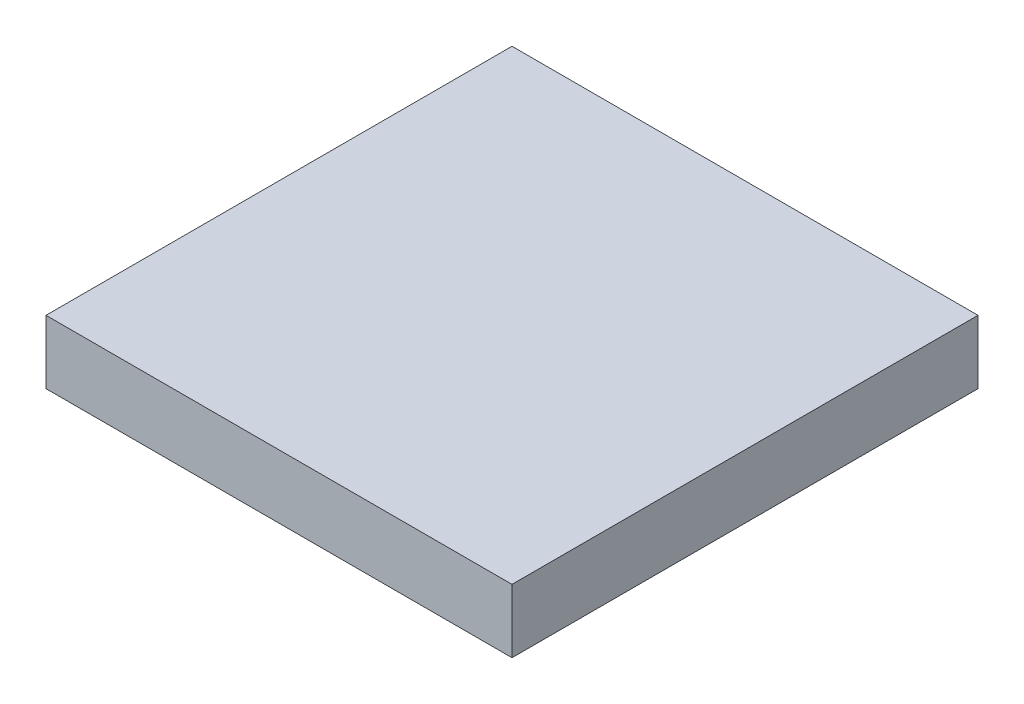
from build123d import *

# Parameters (mm, degrees)
SKETCH1_W           = 220
SKETCH1_H           = 220
BOSS_EXTRUDE1_DEPTH = 30


with BuildPart() as part:
    # Sketch1 → Boss-Extrude1 (new body)
    with BuildSketch(Plane(origin=(0, 0, 0), x_dir=(1, 0, 0), z_dir=(0, 1, 0))):
        with Locations((110, 110)):
            Rectangle(SKETCH1_W, SKETCH1_H)
    extrude(amount=BOSS_EXTRUDE1_DEPTH)


solid = part.part
